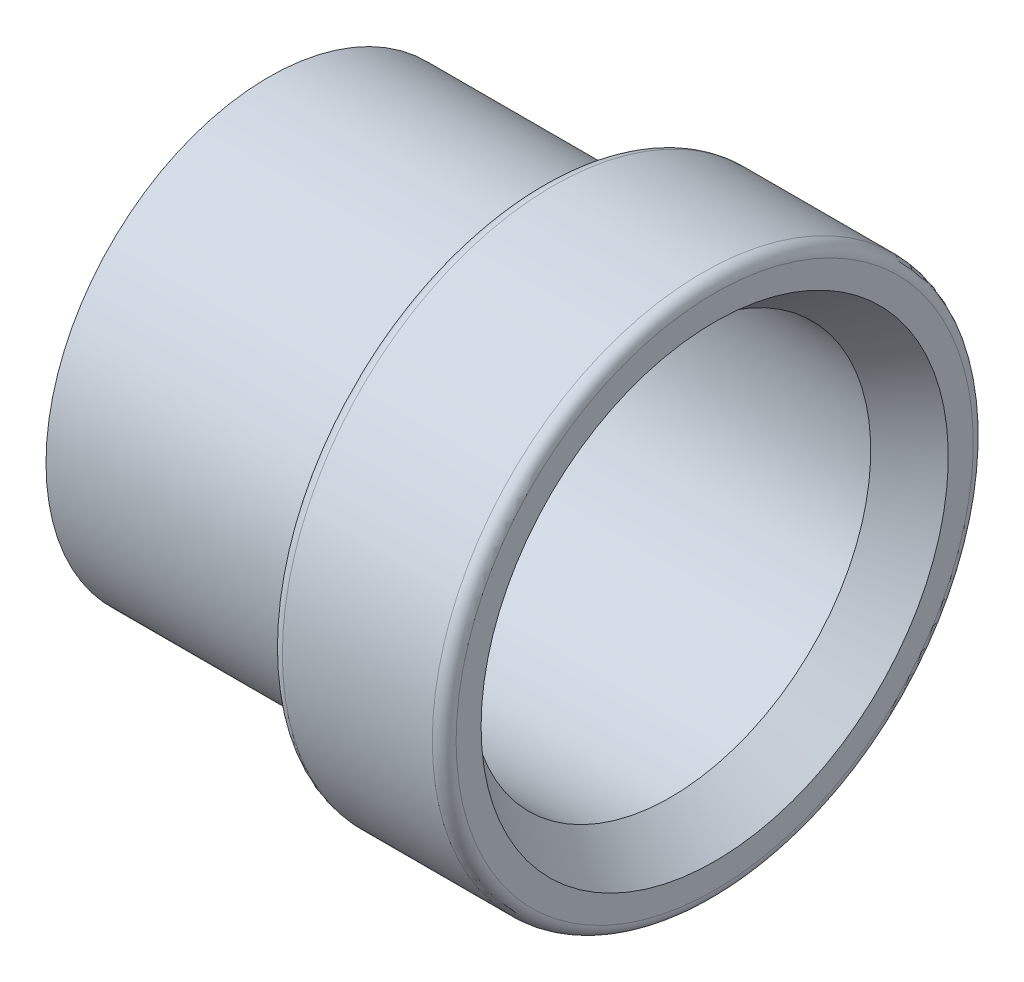
from build123d import *


with BuildPart() as part:
    # Sketch1 → Revolve1 (revolve)
    with BuildSketch(Plane.XY, mode=Mode.PRIVATE) as revolve1_sk:
        with BuildLine():
            Line((-7.1374, 6.4135), (5.721708584, 6.4135))
            Line((5.721708584, 6.4135), (7.1374, 7.4803))
            Line((7.1374, 7.4803), (7.1374, 8.2804))
            ThreePointArc((7.1374, 8.2804), (7.025807684, 8.549807684), (6.7564, 8.6614))
            Line((6.7564, 8.6614), (1.9558, 8.6614))
            ThreePointArc((1.9558, 8.6614), (1.686392316, 8.549807684), (1.5748, 8.2804))
            Line((1.5748, 8.2804), (1.5748, 7.1374))
            Line((1.5748, 7.1374), (-7.1374, 7.1374))
            Line((-7.1374, 7.1374), (-7.1374, 6.4135))
        make_face()
    revolve(revolve1_sk.sketch.rotate(Axis((-7.1374, 0, 0), (1, 0, 0)), 90), axis=Axis((-7.1374, 0, 0), (1, 0, 0)))


solid = part.part
